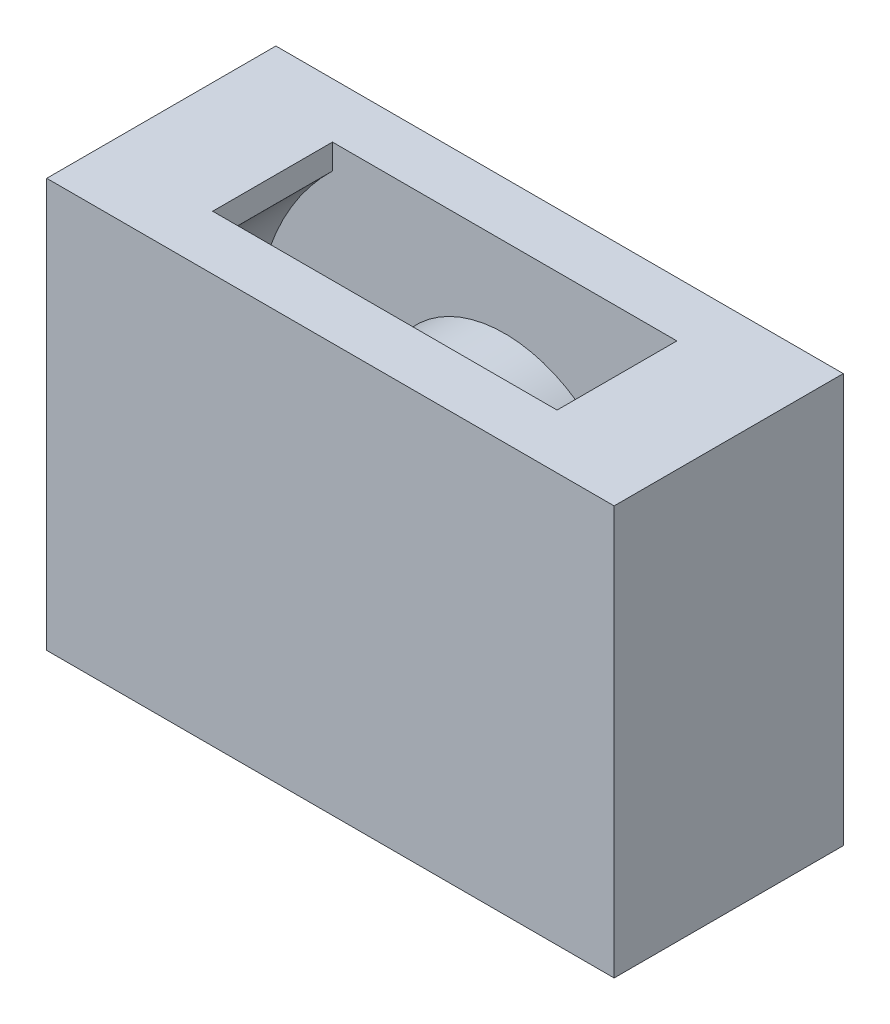
from build123d import *

# Parameters (mm, degrees)
SKETCH_1_W          = 24.91
SKETCH_1_H          = 17.95
EXTRUDE_1_DEPTH     = 7.65
CUT_EXTRUDE_1_DEPTH = 5.26
SKETCH_3_R          = 5.48
EXTRUDE_2_DEPTH     = 7.65
SKETCH_4_W          = 24.91
SKETCH_4_H          = 17.95
EXTRUDE_3_DEPTH     = 2.41


with BuildPart() as part:
    # 草图1 → 凸台-拉伸1 (new body)
    with BuildSketch(Plane.XY):
        Rectangle(SKETCH_1_W, SKETCH_1_H)
    extrude(amount=EXTRUDE_1_DEPTH)

    # 草图2 → 切除-拉伸1 (cut)
    with BuildSketch(Plane(origin=(0, 0, 0), x_dir=(-1, 0, 0), z_dir=(0, 0, -1))):
        with BuildLine():
            Line((-7.56, -8.975), (-7.56, -7.872967992))
            ThreePointArc((-7.56, -7.872967992), (-10.915, 0), (-7.56, 7.872967992))
            Line((-7.56, 7.872967992), (-7.56, 8.975))
            Line((-7.56, 8.975), (7.56, 8.975))
            Line((7.56, 8.975), (7.56, 7.872967992))
            ThreePointArc((7.56, 7.872967992), (10.915, 0), (7.56, -7.872967992))
            Line((7.56, -7.872967992), (7.56, -8.975))
            Line((7.56, -8.975), (-7.56, -8.975))
        make_face()
    extrude(amount=-CUT_EXTRUDE_1_DEPTH, mode=Mode.SUBTRACT)

    # 草图3 → 凸台-拉伸2 (add)
    with BuildSketch(Plane.XY.offset(7.65)):
        Circle(SKETCH_3_R)
    extrude(amount=-EXTRUDE_2_DEPTH)

    # 草图4 → 凸台-拉伸3 (add)
    with BuildSketch(Plane.XY):
        Rectangle(SKETCH_4_W, SKETCH_4_H)
    extrude(amount=-EXTRUDE_3_DEPTH)


solid = part.part
